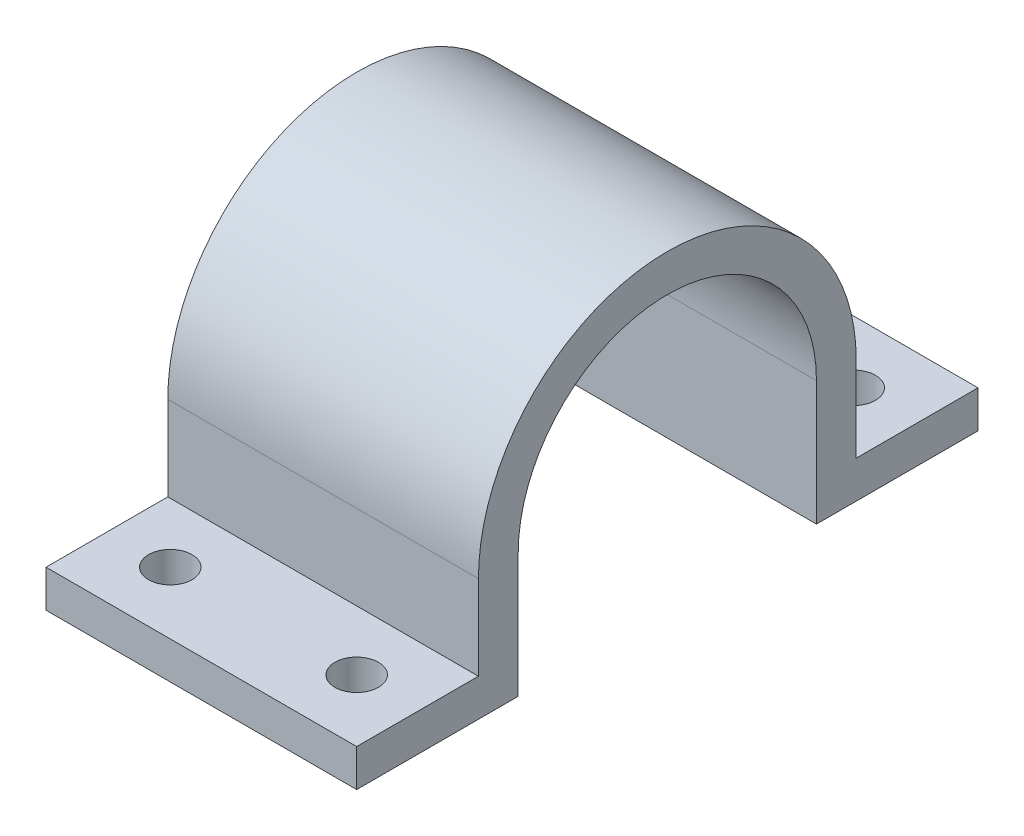
from build123d import *

# Parameters (mm, degrees)
BOSS_EXTRUDE1_DEPTH = 25
CUT_EXTRUDE1_DEPTH  = 44.301270189
SKETCH3_R           = 1.75
CUT_EXTRUDE2_DEPTH  = 42.641325627


with BuildPart() as part:
    # Sketch1 → Boss-Extrude1 (new body)
    with BuildSketch(Plane(origin=(0, 0, 0), x_dir=(0, 0, -1), z_dir=(1, 0, 0))):
        with BuildLine():
            Line((-25, 0), (-25, 3))
            Line((-25, 3), (-15.2, 3))
            Line((-15.2, 3), (-15.2, 9.8))
            ThreePointArc((-15.2, 9.8), (0, 25), (15.2, 9.8))
            Line((15.2, 9.8), (15.2, 3))
            Line((15.2, 3), (25, 3))
            Line((25, 3), (25, 0))
            Line((25, 0), (-25, 0))
        make_face()
    extrude(amount=BOSS_EXTRUDE1_DEPTH)

    # Sketch2 → Cut-Extrude1 (cut, through all)
    with BuildSketch(Plane(origin=(25, 0, 0), x_dir=(0, 0, -1), z_dir=(1, 0, 0))):
        with BuildLine():
            Line((-12, 10), (-12, 0))
            Line((-12, 0), (12, 0))
            Line((12, 0), (12, 10))
            ThreePointArc((12, 10), (0, 22), (-12, 10))
        make_face()
    extrude(amount=-CUT_EXTRUDE1_DEPTH, mode=Mode.SUBTRACT)

    # Sketch3 → Cut-Extrude2 (cut, through all)
    with BuildSketch(Plane(origin=(0, 3, 0), x_dir=(1, 0, 0), z_dir=(0, 1, 0))):
        with Locations(Location((5, -20, 0), (0, 0, 270))):
            Circle(SKETCH3_R)
        with Locations(Location((20, -20, 0), (0, 0, 270))):
            Circle(SKETCH3_R)
        with Locations(Location((5, 20, 0), (0, 0, 270))):
            Circle(SKETCH3_R)
        with Locations(Location((20, 20, 0), (0, 0, 270))):
            Circle(SKETCH3_R)
    extrude(amount=-CUT_EXTRUDE2_DEPTH, mode=Mode.SUBTRACT)


solid = part.part
